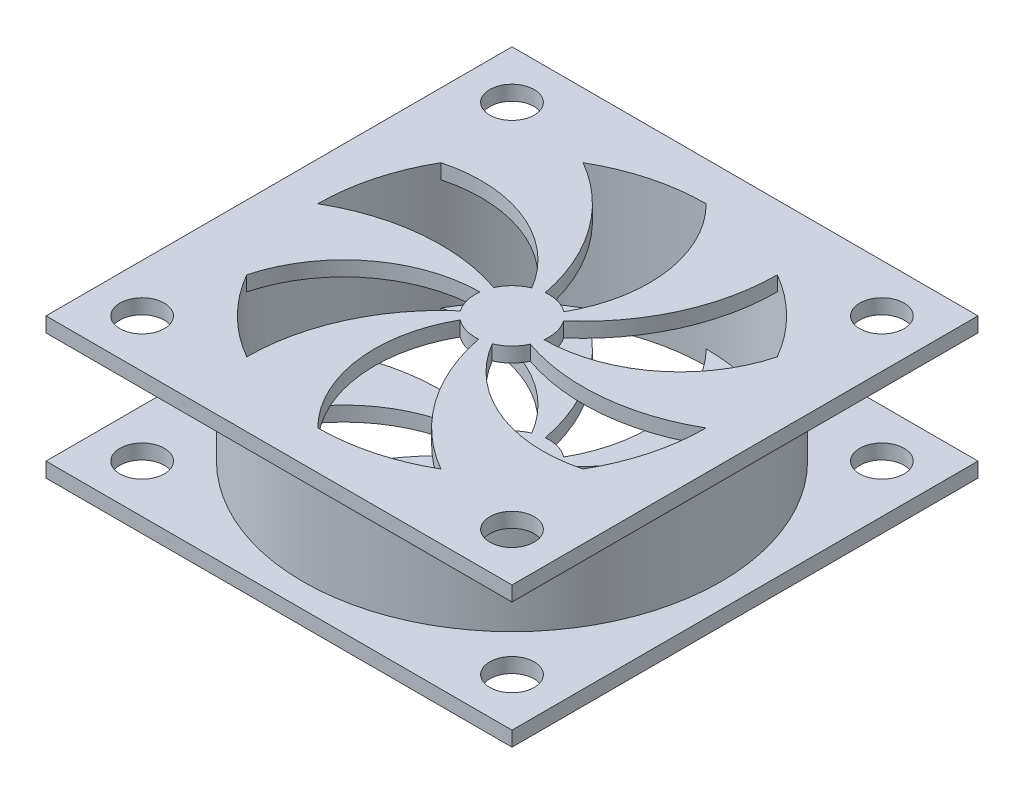
from build123d import *

# Parameters (mm, degrees)
SKETCH1_W           = 40
SKETCH1_H           = 40
SKETCH1_R           = 16.66875
SKETCH1_R_2         = 1.905
BOSS_EXTRUDE1_DEPTH = 1.27
SKETCH2_R           = 17.93875
SKETCH2_R_2         = 16.66875
BOSS_EXTRUDE2_DEPTH = 9.525
SKETCH3_W           = 40
SKETCH3_H           = 40
SKETCH3_R           = 16.66875
SKETCH3_R_2         = 1.905
BOSS_EXTRUDE3_DEPTH = 1.27
BOSS_EXTRUDE4_DEPTH = 1.27
BOSS_EXTRUDE5_START = -1.27
BOSS_EXTRUDE5_DEPTH = 1.27


with BuildPart() as part:
    # Sketch1 → Boss-Extrude1 (new body)
    with BuildSketch(Plane(origin=(0, 0, 0), x_dir=(1, 0, 0), z_dir=(0, 1, 0))):
        Rectangle(SKETCH1_W, SKETCH1_H)
        Circle(SKETCH1_R, mode=Mode.SUBTRACT)
        with Locations((-15.875, 15.875)):
            Circle(SKETCH1_R_2, mode=Mode.SUBTRACT)
        with Locations((15.875, 15.875)):
            Circle(SKETCH1_R_2, mode=Mode.SUBTRACT)
        with Locations((-15.875, -15.875)):
            Circle(SKETCH1_R_2, mode=Mode.SUBTRACT)
        with Locations((15.875, -15.875)):
            Circle(SKETCH1_R_2, mode=Mode.SUBTRACT)
    extrude(amount=BOSS_EXTRUDE1_DEPTH)

    # Sketch2 → Boss-Extrude2 (add)
    with BuildSketch(Plane(origin=(0, 1.27, 0), x_dir=(1, 0, 0), z_dir=(0, 1, 0))):
        Circle(SKETCH2_R)
        Circle(SKETCH2_R_2, mode=Mode.SUBTRACT)
    extrude(amount=BOSS_EXTRUDE2_DEPTH)

    # Sketch3 → Boss-Extrude3 (add)
    with BuildSketch(Plane(origin=(0, 10.795, 0), x_dir=(1, 0, 0), z_dir=(0, 1, 0))):
        Rectangle(SKETCH3_W, SKETCH3_H)
        Circle(SKETCH3_R, mode=Mode.SUBTRACT)
        with Locations((-15.875, 15.875)):
            Circle(SKETCH3_R_2, mode=Mode.SUBTRACT)
        with Locations((15.875, 15.875)):
            Circle(SKETCH3_R_2, mode=Mode.SUBTRACT)
        with Locations((-15.875, -15.875)):
            Circle(SKETCH3_R_2, mode=Mode.SUBTRACT)
        with Locations((15.875, -15.875)):
            Circle(SKETCH3_R_2, mode=Mode.SUBTRACT)
    extrude(amount=BOSS_EXTRUDE3_DEPTH)

    # Sketch4 → Boss-Extrude4 (add)
    with BuildSketch(Plane.XZ):
        with BuildLine():
            ThreePointArc((-2.585941795, 1.84215364), (-3.079306216, 0.773626673), (-3.149549386, -0.401202774))
            ThreePointArc((-3.149549386, -0.401202774), (-10.265002832, 2.064243556), (-14.435560949, 8.334375))
            ThreePointArc((-14.435560949, 8.334375), (-16.100776117, 4.314189958), (-16.66875, 0))
            ThreePointArc((-16.66875, 0), (-9.921875, -2.157421613), (-2.888322747, -1.318414467))
            ThreePointArc((-2.888322747, -1.318414467), (-2.20963346, -2.279944073), (-1.227322899, -2.928191166))
            ThreePointArc((-1.227322899, -2.928191166), (-6.920188775, -7.857631444), (-14.435560949, -8.334375))
            ThreePointArc((-14.435560949, -8.334375), (-11.786586159, -11.786586159), (-8.334375, -14.435560949))
            ThreePointArc((-8.334375, -14.435560949), (-3.092555577, -9.67130661), (-0.302380952, -3.160568107))
            ThreePointArc((-0.302380952, -3.160568107), (0.869672756, -3.053570745), (1.922226487, -2.526988392))
            ThreePointArc((1.922226487, -2.526988392), (3.344814057, -9.921875), (0, -16.66875))
            ThreePointArc((0, -16.66875), (4.314189958, -16.100776117), (8.334375, -14.435560949))
            ThreePointArc((8.334375, -14.435560949), (6.829319423, -7.513884997), (2.585941795, -1.84215364))
            ThreePointArc((2.585941795, -1.84215364), (3.079306216, -0.773626673), (3.149549386, 0.401202774))
            ThreePointArc((3.149549386, 0.401202774), (10.265002832, -2.064243556), (14.435560949, -8.334375))
            ThreePointArc((14.435560949, -8.334375), (16.100776117, -4.314189958), (16.66875, 0))
            ThreePointArc((16.66875, 0), (9.921875, 2.157421613), (2.888322747, 1.318414467))
            ThreePointArc((2.888322747, 1.318414467), (2.20963346, 2.279944073), (1.227322899, 2.928191166))
            ThreePointArc((1.227322899, 2.928191166), (6.920188775, 7.857631444), (14.435560949, 8.334375))
            ThreePointArc((14.435560949, 8.334375), (11.786586159, 11.786586159), (8.334375, 14.435560949))
            ThreePointArc((8.334375, 14.435560949), (3.092555577, 9.67130661), (0.302380952, 3.160568107))
            ThreePointArc((0.302380952, 3.160568107), (-0.869672756, 3.053570745), (-1.922226487, 2.526988392))
            ThreePointArc((-1.922226487, 2.526988392), (-3.344814057, 9.921875), (0, 16.66875))
            ThreePointArc((0, 16.66875), (-4.314189958, 16.100776117), (-8.334375, 14.435560949))
            ThreePointArc((-8.334375, 14.435560949), (-6.829319423, 7.513884997), (-2.585941795, 1.84215364))
        make_face()
    extrude(amount=-BOSS_EXTRUDE4_DEPTH)

    # Sketch5 → Boss-Extrude5 (add)
    with BuildSketch(Plane(origin=(0, 12.065, 0), x_dir=(1, 0, 0), z_dir=(0, 1, 0)).offset(BOSS_EXTRUDE5_START)):
        with BuildLine():
            ThreePointArc((1.227322899, -2.928191166), (6.920188775, -7.857631444), (14.435560949, -8.334375))
            ThreePointArc((14.435560949, -8.334375), (11.786586159, -11.786586159), (8.334375, -14.435560949))
            ThreePointArc((8.334375, -14.435560949), (3.092555577, -9.67130661), (0.302380952, -3.160568107))
            ThreePointArc((0.302380952, -3.160568107), (-0.869672756, -3.053570745), (-1.922226487, -2.526988392))
            ThreePointArc((-1.922226487, -2.526988392), (-3.344814057, -9.921875), (0, -16.66875))
            ThreePointArc((0, -16.66875), (-4.314189958, -16.100776117), (-8.334375, -14.435560949))
            ThreePointArc((-8.334375, -14.435560949), (-6.829319423, -7.513884997), (-2.585941795, -1.84215364))
            ThreePointArc((-2.585941795, -1.84215364), (-3.079306216, -0.773626673), (-3.149549386, 0.401202774))
            ThreePointArc((-3.149549386, 0.401202774), (-10.265002832, -2.064243556), (-14.435560949, -8.334375))
            ThreePointArc((-14.435560949, -8.334375), (-16.100776117, -4.314189958), (-16.66875, 0))
            ThreePointArc((-16.66875, 0), (-9.921875, 2.157421613), (-2.888322747, 1.318414467))
            ThreePointArc((-2.888322747, 1.318414467), (-2.20963346, 2.279944073), (-1.227322899, 2.928191166))
            ThreePointArc((-1.227322899, 2.928191166), (-6.920188775, 7.857631444), (-14.435560949, 8.334375))
            ThreePointArc((-14.435560949, 8.334375), (-11.786586159, 11.786586159), (-8.334375, 14.435560949))
            ThreePointArc((-8.334375, 14.435560949), (-3.092555577, 9.67130661), (-0.302380952, 3.160568107))
            ThreePointArc((-0.302380952, 3.160568107), (0.869672756, 3.053570745), (1.922226487, 2.526988392))
            ThreePointArc((1.922226487, 2.526988392), (3.344814057, 9.921875), (0, 16.66875))
            ThreePointArc((0, 16.66875), (4.314189958, 16.100776117), (8.334375, 14.435560949))
            ThreePointArc((8.334375, 14.435560949), (6.829319423, 7.513884997), (2.585941795, 1.84215364))
            ThreePointArc((2.585941795, 1.84215364), (3.079306216, 0.773626673), (3.149549386, -0.401202774))
            ThreePointArc((3.149549386, -0.401202774), (10.265002832, 2.064243556), (14.435560949, 8.334375))
            ThreePointArc((14.435560949, 8.334375), (16.100776117, 4.314189958), (16.66875, 0))
            ThreePointArc((16.66875, 0), (9.921875, -2.157421613), (2.888322747, -1.318414467))
            ThreePointArc((2.888322747, -1.318414467), (2.20963346, -2.279944073), (1.227322899, -2.928191166))
        make_face()
    extrude(amount=BOSS_EXTRUDE5_DEPTH)


solid = part.part
